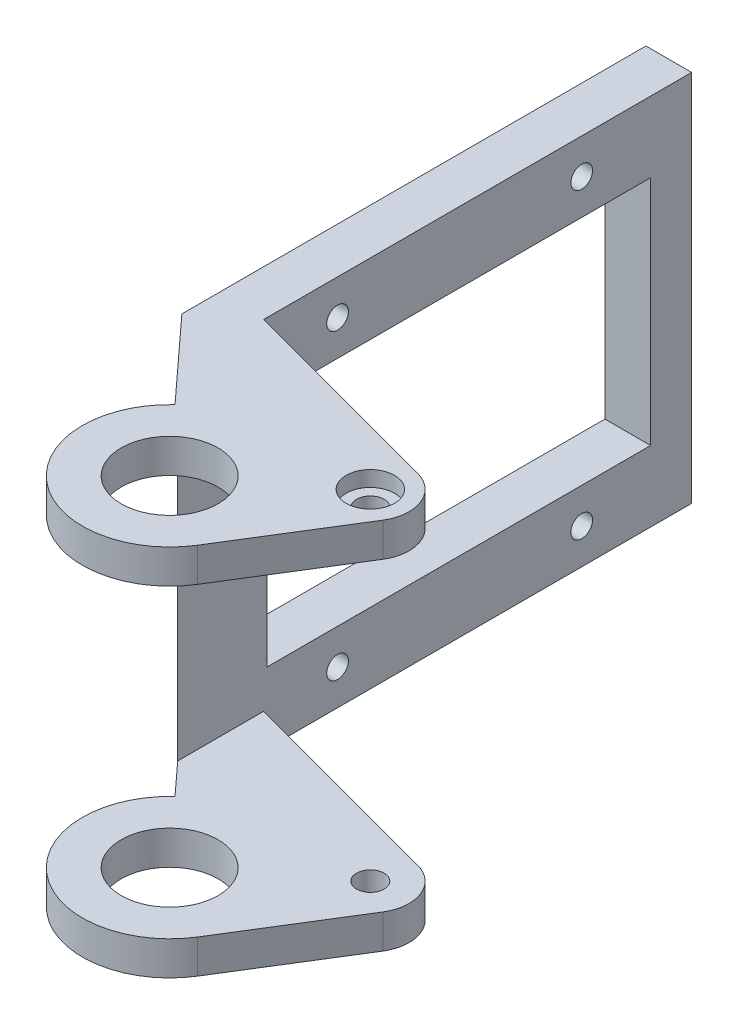
from build123d import *

# Parameters (mm, degrees)
BOSS_EXTRUDE1_DEPTH             = 15.286125003
SKETCH2_R                       = 7.14375
BOSS_EXTRUDE2_DEPTH             = 15.286125003
SKETCH6_W                       = 19.2375
SKETCH6_H                       = 25.016000006
CUT_EXTRUDE2_DEPTH              = 61.357880858
SKETCH3_R                       = 3.96875
CUT_EXTRUDE1_DEPTH              = 60.821922992
SKETCH8_W                       = 66.63419502
SKETCH8_H                       = 42.602555688
CUT_EXTRUDE3_DEPTH              = 1.016
SKETCH10_R                      = 0.535
CUT_EXTRUDE4_DEPTH              = 54.425779111
SKETCH11_R                      = 1.25
CUT_EXTRUDE5_DEPTH              = 53.493702948
SKETCH12_W                      = 31.422
SKETCH12_H                      = 19
CUT_EXTRUDE6_DEPTH              = 55.226247972
F_2_56_TAPPED_HOLE1_D           = 1.778
F_2_56_TAPPED_HOLE1_CSINK_D     = 5.1
F_2_56_TAPPED_HOLE1_CSINK_ANGLE = 82
SKETCH16_R                      = 1.1303
BOSS_EXTRUDE3_DEPTH             = 2.778125
FILLET1_R                       = 3.175
SKETCH17_R                      = 1.984375
CUT_EXTRUDE7_DEPTH              = 1.27


with BuildPart() as part:
    # Sketch1 → Boss-Extrude1 (new, symmetric)
    with BuildSketch(Plane(origin=(0, 0, 0), x_dir=(1, 0, 0), z_dir=(0, 1, 0))):
        Polygon((0, 0), (-12, 13.095702013), (-12, 50), (12, 50), (12, 34.142074657), (12, 2.115923769), align=None)
    extrude(amount=BOSS_EXTRUDE1_DEPTH, both=True)

    # Sketch2 → Boss-Extrude2 (add, symmetric)
    with BuildSketch(Plane(origin=(0, 0, 0), x_dir=(1, 0, 0), z_dir=(0, 1, 0))):
        Circle(SKETCH2_R)
    extrude(amount=BOSS_EXTRUDE2_DEPTH, both=True)

    # Sketch6 → Cut-Extrude2 (cut, through all)
    with BuildSketch(Plane(origin=(0, 0, -50), x_dir=(-1, 0, 0), z_dir=(0, 0, -1))):
        with Locations((-2.38125, 0)):
            Rectangle(SKETCH6_W, SKETCH6_H)
    extrude(amount=-CUT_EXTRUDE2_DEPTH, mode=Mode.SUBTRACT)

    # Sketch3 → Cut-Extrude1 (cut, through all)
    with BuildSketch(Plane(origin=(0, 15.286125003, 0), x_dir=(1, 0, 0), z_dir=(0, 1, 0))):
        with Locations(Location((0, 0, 0), (0, 0, 270))):
            Circle(SKETCH3_R)
        with BuildLine():
            Line((-7.2375, 50), (-7.2375, 14.947736973))
            Line((-7.2375, 14.947736973), (4.778546429, 5.325377349))
            ThreePointArc((4.778546429, 5.325377349), (6.254946944, 3.474160131), (7.046308067, 1.242454227))
            Line((7.046308067, 1.242454227), (12, 1.242454227))
            Line((12, 1.242454227), (12, 50))
            Line((12, 50), (-7.2375, 50))
        make_face()
    extrude(amount=-CUT_EXTRUDE1_DEPTH, mode=Mode.SUBTRACT)

    # Sketch8 → Cut-Extrude3 (cut)
    with BuildSketch(Plane.ZY.offset(12)):
        with Locations((-30.86956361, 0)):
            Rectangle(SKETCH8_W, SKETCH8_H)
    extrude(amount=-CUT_EXTRUDE3_DEPTH, mode=Mode.SUBTRACT)

    # Sketch10 → Cut-Extrude4 (cut, through all)
    with BuildSketch(Plane(origin=(0, 0, 0), x_dir=(0.6755902076156618, 0, 0.7372773368101228), z_dir=(-0.7372773368101228, 0, 0.6755902076156618))):
        with Locations((-15.2456, 0)):
            Circle(SKETCH10_R)
    extrude(amount=-CUT_EXTRUDE4_DEPTH, mode=Mode.SUBTRACT)

    # Sketch11 → Cut-Extrude5 (cut, through all)
    with BuildSketch(Plane(origin=(1.474554674, 0, -1.351180415), x_dir=(-0.6755902076156618, 0, -0.7372773368101228), z_dir=(0.7372773368101228, 0, -0.6755902076156618))):
        with Locations(Location((15.2456, 0, 0), (0, 0, 180))):
            Circle(SKETCH11_R)
    extrude(amount=CUT_EXTRUDE5_DEPTH, mode=Mode.SUBTRACT)

    # Sketch12 → Cut-Extrude6 (cut, through all)
    with BuildSketch(Plane(origin=(-7.2375, 0, 0), x_dir=(0, 0, -1), z_dir=(1, 0, 0))):
        with Locations((30.928944618, 0)):
            Rectangle(SKETCH12_W, SKETCH12_H)
    extrude(amount=-CUT_EXTRUDE6_DEPTH, mode=Mode.SUBTRACT)

    # #2-56 Tapped Hole1 (through all)
    with Locations(Plane.ZY.offset(10.984)):
        with Locations((-40.993466288, 12.393062501), (-20.993466288, 12.393062501), (-20.993466288, -12.393062502), (-40.993466288, -12.393062502)):
            CounterSinkHole(F_2_56_TAPPED_HOLE1_D / 2, F_2_56_TAPPED_HOLE1_CSINK_D / 2, counter_sink_angle=F_2_56_TAPPED_HOLE1_CSINK_ANGLE)

    # Sketch16 → Boss-Extrude3 (add)
    with BuildSketch(Plane(origin=(0, 15.286125003, 0), x_dir=(1, 0, 0), z_dir=(0, 1, 0))):
        with BuildLine():
            Line((-7.2375, 14.947736973), (14.130165839, 9.222288167))
            Line((14.130165839, 9.222288167), (6.070032359, -3.766679071))
            ThreePointArc((6.070032359, -3.766679071), (7.018445947, 1.332133834), (4.267739155, 5.728836406))
            Line((4.267739155, 5.728836406), (-7.2375, 14.947736973))
        make_face()
        with Locations(Location((9.177355102, 7.262387932, 0), (0, 0, 270))):
            Circle(SKETCH16_R, mode=Mode.SUBTRACT)
    boss_extrude3 = extrude(amount=-BOSS_EXTRUDE3_DEPTH)

    # Mirror4: Boss-Extrude3 across plane
    add(boss_extrude3.mirror(Plane.ZX))

    # Fillet1
    fillet1_edges = [part.edges().sort_by_distance(p)[0] for p in [
        (14.130165839, 13.897062503, -9.222288167),
        (14.130165839, -13.897062503, -9.222288167),
    ]]
    fillet(fillet1_edges, radius=FILLET1_R)

    # Sketch17 → Cut-Extrude7 (cut)
    with BuildSketch(Plane(origin=(0, 15.286125003, 0), x_dir=(1, 0, 0), z_dir=(0, 1, 0))):
        with Locations(Location((9.177355102, 7.262387932, 0), (0, 0, 270))):
            Circle(SKETCH17_R)
    extrude(amount=-CUT_EXTRUDE7_DEPTH, mode=Mode.SUBTRACT)


solid = part.part
